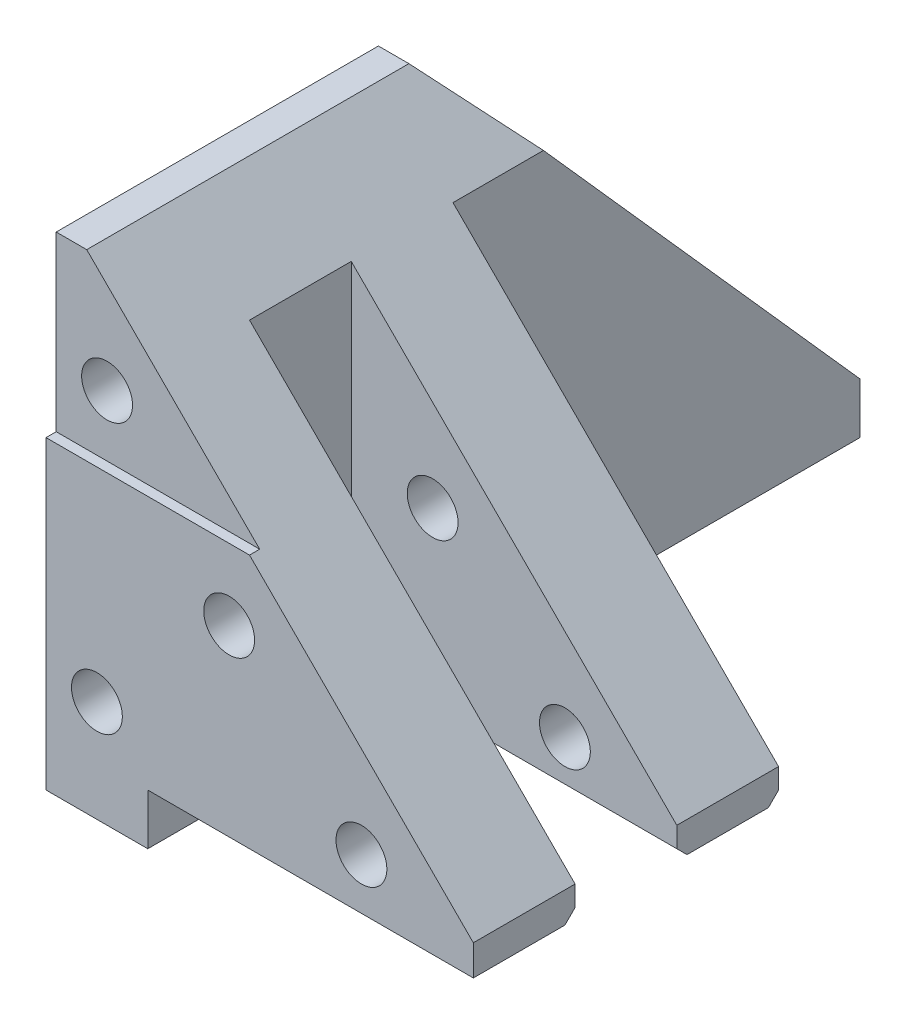
from build123d import *

# Parameters (mm, degrees)
EXTRUDE_1_DEPTH          = 70
CUT_EXTRUDE_1_DEPTH      = 100.498743711
SKETCH_4_W               = 45.819685342
SKETCH_4_H               = 5
CUT_EXTRUDE_2_DEPTH      = 96.72878355
SKETCH_5_W               = 32
SKETCH_5_H               = 10
SKETCH_5_H_2             = 40
CUT_EXTRUDE_3_DEPTH      = 94.214805691
CUT_EXTRUDE_4_DEPTH      = 1
SKETCH_7_R               = 3.75
CUT_EXTRUDE_5_DEPTH      = 10
CUT_EXTRUDE_6_REACH      = 97.729
SKETCH_8_R               = 2.5
CUT_EXTRUDE_7_DEPTH      = 92.782351245
CUT_EXTRUDE_7_DEPTH_BACK = 92.782351245
CUT_EXTRUDE_8_DEPTH      = 96
CHAMFER_1_SIZE           = 1


with BuildPart() as part:
    # 草图1 → 拉伸1 (new body)
    with BuildSketch(Plane.XY):
        Polygon((0, 0), (50, 0), (0, 50), align=None)
    extrude(amount=EXTRUDE_1_DEPTH)

    # 草图3 → 切除-拉伸1 (cut, through all)
    with BuildSketch(Plane.XY.offset(70)):
        Polygon((50, 0), (42, 0), (42, 8), align=None)
    extrude(amount=-CUT_EXTRUDE_1_DEPTH, mode=Mode.SUBTRACT)

    # 草图4 → 切除-拉伸2 (cut, through all)
    with BuildSketch(Plane.XY.offset(70)):
        with Locations((32.909842671, 2.5)):
            Rectangle(SKETCH_4_W, SKETCH_4_H)
    extrude(amount=-CUT_EXTRUDE_2_DEPTH, mode=Mode.SUBTRACT)

    # 草图5 → 切除-拉伸3 (cut, through all)
    with BuildSketch(Plane.XZ.offset(-5)):
        with Locations((26, 55)):
            Rectangle(SKETCH_5_W, SKETCH_5_H)
        with Locations((26, 20)):
            Rectangle(SKETCH_5_W, SKETCH_5_H_2)
    extrude(amount=-CUT_EXTRUDE_3_DEPTH, mode=Mode.SUBTRACT)

    # 草图6 → 切除-拉伸4 (cut)
    with BuildSketch(Plane.XY.offset(70)):
        Polygon((0, 50), (0, 30), (20, 30), align=None)
    extrude(amount=-CUT_EXTRUDE_4_DEPTH, mode=Mode.SUBTRACT)

    # 草图7 → 切除-拉伸5 (cut)
    with BuildSketch(Plane.XZ.offset(-5)):
        with Locations(Location((16, 65, 0), (0, 0, 270))):
            Circle(SKETCH_7_R)
    extrude(amount=-CUT_EXTRUDE_5_DEPTH, mode=Mode.SUBTRACT)

    # 切除-拉伸6: up to this face of the body (flat: up to its plane)
    cut_extrude_6_end = Plane(part.part.faces().sort_by_distance((21.50877193, 16.745614035, 40))[0])
    # 草图8 → 切除-拉伸6 (cut, up to the picked face)
    with BuildSketch(Plane.XY.offset(70), mode=Mode.PRIVATE) as cut_extrude_6_sk1:
        with Locations((5, 36)):
            Circle(SKETCH_8_R)
    cut_extrude_6_tool1 = split(extrude(cut_extrude_6_sk1.sketch, amount=-CUT_EXTRUDE_6_REACH, mode=Mode.PRIVATE), bisect_by=cut_extrude_6_end, keep=Keep.BOTH, mode=Mode.PRIVATE)
    # 草图8 → 切除-拉伸6 (cut, up to the picked face)
    with BuildSketch(Plane.XY.offset(70), mode=Mode.PRIVATE) as cut_extrude_6_sk2:
        with Locations((5, 10)):
            Circle(SKETCH_8_R)
    cut_extrude_6_tool2 = split(extrude(cut_extrude_6_sk2.sketch, amount=-CUT_EXTRUDE_6_REACH, mode=Mode.PRIVATE), bisect_by=cut_extrude_6_end, keep=Keep.BOTH, mode=Mode.PRIVATE)
    # 草图8 → 切除-拉伸6 (cut, up to the picked face)
    with BuildSketch(Plane.XY.offset(70), mode=Mode.PRIVATE) as cut_extrude_6_sk3:
        with Locations((31, 10)):
            Circle(SKETCH_8_R)
    cut_extrude_6_tool3 = split(extrude(cut_extrude_6_sk3.sketch, amount=-CUT_EXTRUDE_6_REACH, mode=Mode.PRIVATE), bisect_by=cut_extrude_6_end, keep=Keep.BOTH, mode=Mode.PRIVATE)
    # 草图8 → 切除-拉伸6 (cut, up to the picked face)
    with BuildSketch(Plane.XY.offset(70), mode=Mode.PRIVATE) as cut_extrude_6_sk4:
        with Locations((18, 23)):
            Circle(SKETCH_8_R)
    cut_extrude_6_tool4 = split(extrude(cut_extrude_6_sk4.sketch, amount=-CUT_EXTRUDE_6_REACH, mode=Mode.PRIVATE), bisect_by=cut_extrude_6_end, keep=Keep.BOTH, mode=Mode.PRIVATE)
    add(cut_extrude_6_tool1.solids().sort_by(Axis((5, 36, 70), (0, 0, -1)))[0], mode=Mode.SUBTRACT)
    add(cut_extrude_6_tool2.solids().sort_by(Axis((5, 10, 70), (0, 0, -1)))[0], mode=Mode.SUBTRACT)
    add(cut_extrude_6_tool3.solids().sort_by(Axis((31, 10, 70), (0, 0, -1)))[0], mode=Mode.SUBTRACT)
    add(cut_extrude_6_tool4.solids().sort_by(Axis((18, 23, 70), (0, 0, -1)))[0], mode=Mode.SUBTRACT)

    # 草图9 → 切除-拉伸7 (cut, two sides: drawn at the far end of the back side and taken through both)
    with BuildSketch(Plane(origin=(10, 0, 0), x_dir=(0, 0, -1), z_dir=(1, 0, 0)).offset(-CUT_EXTRUDE_7_DEPTH_BACK)):
        Polygon((182.046505341, 50), (0, 50), (-40, 50), (0, 5), (120.945115134, -131.063254526), (465.924736836, -247.479666759), (527.026127043, -66.416412233), align=None)
    extrude(amount=CUT_EXTRUDE_7_DEPTH + CUT_EXTRUDE_7_DEPTH_BACK, mode=Mode.SUBTRACT)

    # 草图10 → 切除-拉伸8 (cut, through all)
    with BuildSketch(Plane.XY.offset(69)):
        Polygon((0, 50), (0, 47), (3, 47), align=None)
    extrude(amount=-CUT_EXTRUDE_8_DEPTH, mode=Mode.SUBTRACT)

    # 倒角1
    chamfer_1_edges = [part.edges().sort_by_distance(p)[0] for p in [
        (26, 5, 60),
        (26, 5, 50),
        (26, 5, 40),
    ]]
    chamfer(chamfer_1_edges, length=CHAMFER_1_SIZE)


solid = part.part
